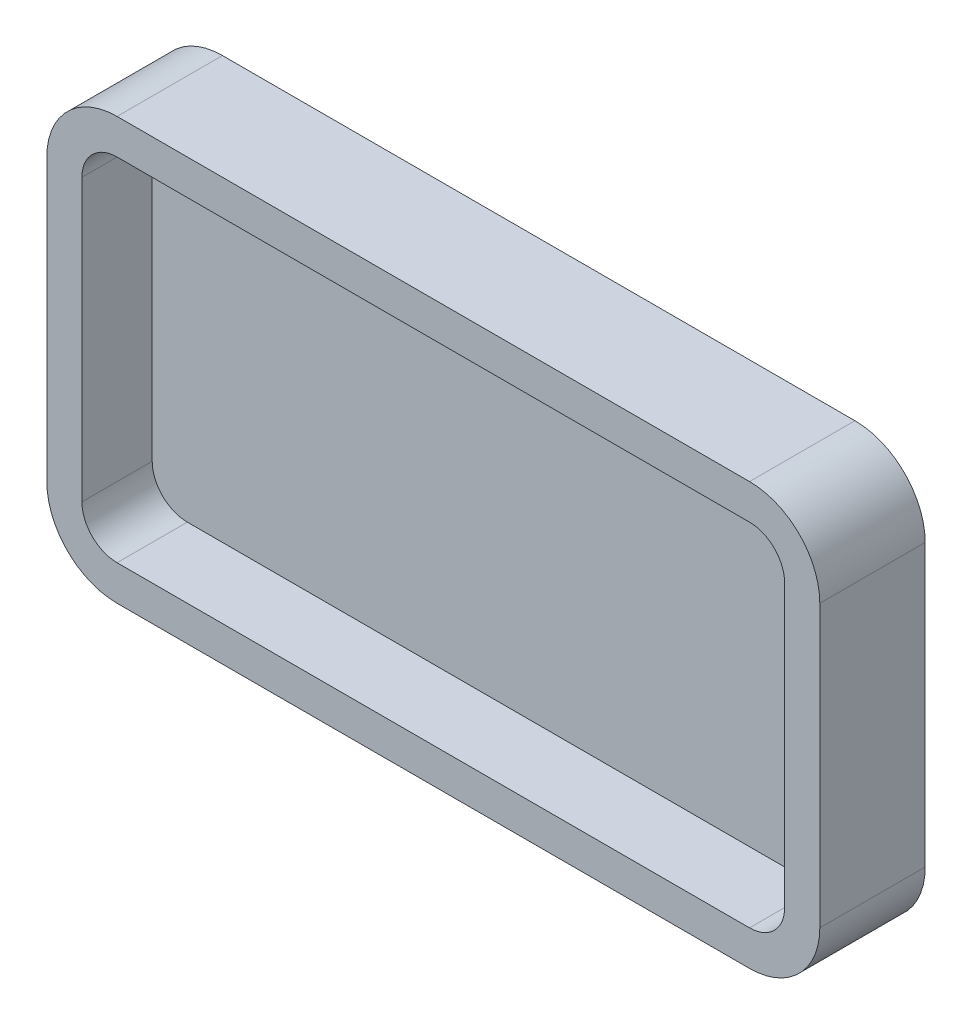
from build123d import *

# Parameters (mm, degrees)
EXTRU_MINCE3_DEPTH = 15
BOSS_EXTRU_2_DEPTH = 5


with BuildPart() as part:
    # Esquisse1 → Extru.-Mince3 (new body)
    with BuildSketch(Plane.XY):
        with BuildLine():
            Line((5, -5), (95, -5))
            ThreePointArc((95, -5), (102.071067812, -2.071067812), (105, 5))
            Line((105, 5), (105, 45))
            ThreePointArc((105, 45), (102.071067812, 52.071067812), (95, 55))
            Line((95, 55), (5, 55))
            ThreePointArc((5, 55), (-2.071067812, 52.071067812), (-5, 45))
            Line((-5, 45), (-5, 5))
            ThreePointArc((-5, 5), (-2.071067812, -2.071067812), (5, -5))
        make_face()
        with BuildLine():
            Line((5, 0), (95, 0))
            ThreePointArc((95, 0), (98.535533906, 1.464466094), (100, 5))
            Line((100, 5), (100, 45))
            ThreePointArc((100, 45), (98.535533906, 48.535533906), (95, 50))
            Line((95, 50), (5, 50))
            ThreePointArc((5, 50), (1.464466094, 48.535533906), (0, 45))
            Line((0, 45), (0, 5))
            ThreePointArc((0, 5), (1.464466094, 1.464466094), (5, 0))
        make_face(mode=Mode.SUBTRACT)
    extrude(amount=EXTRU_MINCE3_DEPTH)

    # Esquisse2 → Boss.-Extru.2 (add)
    with BuildSketch(Plane.XY):
        with BuildLine():
            Line((5, 50), (95, 50))
            ThreePointArc((95, 50), (98.535533906, 48.535533906), (100, 45))
            Line((100, 45), (100, 5))
            ThreePointArc((100, 5), (98.535533906, 1.464466094), (95, 0))
            Line((95, 0), (5, 0))
            ThreePointArc((5, 0), (1.464466094, 1.464466094), (0, 5))
            Line((0, 5), (0, 45))
            ThreePointArc((0, 45), (1.464466094, 48.535533906), (5, 50))
        make_face()
    extrude(amount=BOSS_EXTRU_2_DEPTH)


solid = part.part
